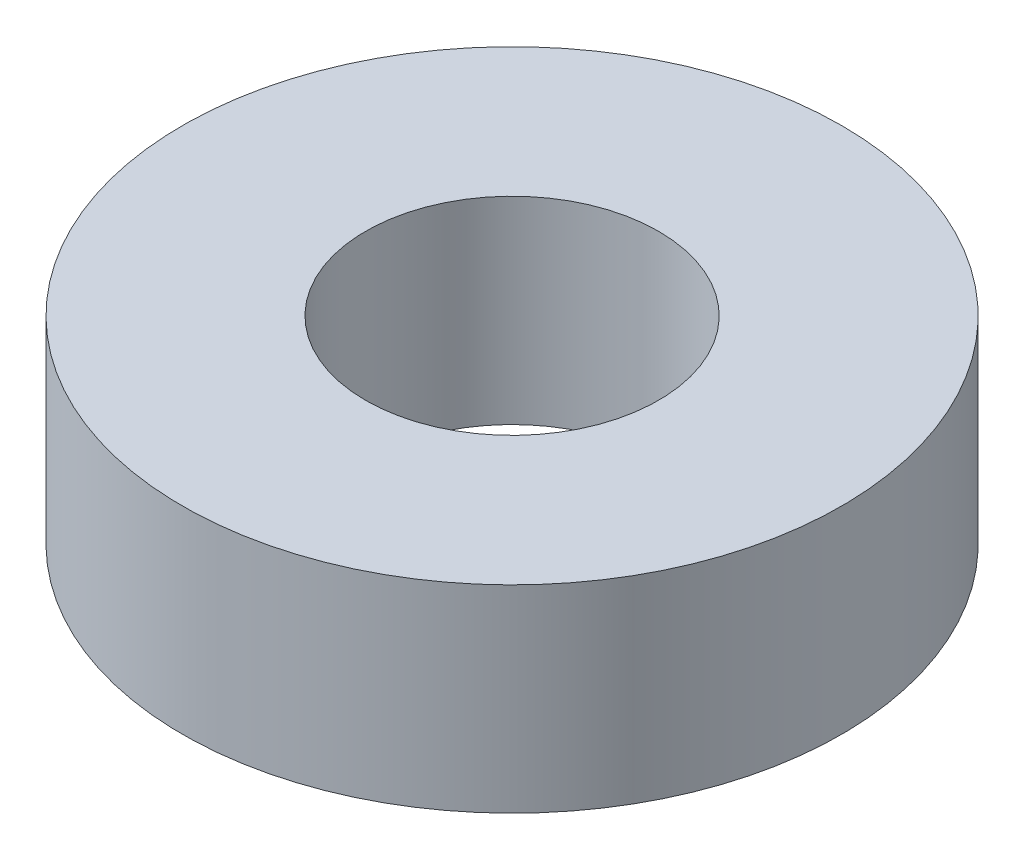
from build123d import *

# Parameters (mm, degrees)
ESBO_O1_R                = 4.5
ESBO_O1_R_2              = 2
RESSALTO_EXTRUS_O1_DEPTH = 2.7


with BuildPart() as part:
    # Esboço1 → Ressalto-extrusão1 (new body)
    with BuildSketch(Plane(origin=(0, 0, 0), x_dir=(1, 0, 0), z_dir=(0, 1, 0))):
        with Locations(Location((0, 0, 0), (0, 0, 90))):
            Circle(ESBO_O1_R)
        with Locations(Location((0, 0, 0), (0, 0, 90))):
            Circle(ESBO_O1_R_2, mode=Mode.SUBTRACT)
    extrude(amount=RESSALTO_EXTRUS_O1_DEPTH)


solid = part.part
